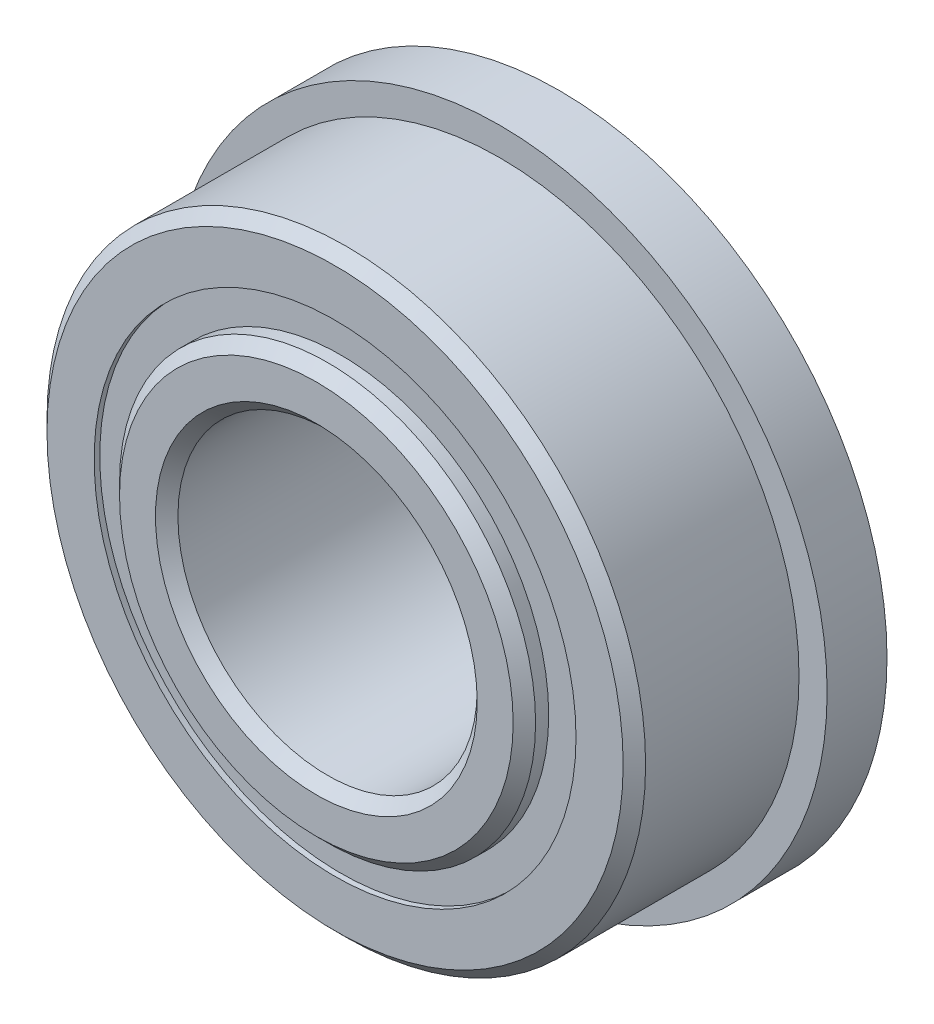
from build123d import *

# Parameters (mm, degrees)
CIRPATTERN1_COUNT = 12
SKETCH5_W         = 1.147826059
SKETCH5_H         = 0.697802198
SKETCH6_W         = 1.27
SKETCH6_H         = 1.835498901


with BuildPart() as part:
    # Sketch1 → Revolve1 (revolve)
    with BuildSketch(Plane(origin=(0, 0, 0), x_dir=(0, 0, -1), z_dir=(1, 0, 0))):
        with BuildLine():
            Line((2.143125, 6.35), (-2.143125, 6.35))
            Line((-2.143125, 6.35), (-2.38125, 6.111875))
            Line((-2.38125, 6.111875), (-2.38125, 5.111401099))
            Line((-2.38125, 5.111401099), (-1.058333333, 5.111401099))
            ThreePointArc((-1.058333333, 5.111401099), (0, 5.876861441), (1.058333333, 5.111401099))
            Line((1.058333333, 5.111401099), (2.38125, 5.111401099))
            Line((2.38125, 5.111401099), (2.38125, 6.111875))
            Line((2.38125, 6.111875), (2.143125, 6.35))
        make_face()
    revolve(axis=Axis((0, 0, 2.38125), (0, 0, -1)))

    # Sketch6 → Revolve6 (revolve)
    with BuildSketch(Plane(origin=(0, 0, 0), x_dir=(0, 0, -1), z_dir=(1, 0, 0))):
        with Locations((1.74625, 6.02915055)):
            Rectangle(SKETCH6_W, SKETCH6_H)
    revolve(axis=Axis((0, 0, -2.38125), (0, 0, 1)))


with BuildPart() as body_2:
    # Sketch3 → Revolve3 (revolve)
    with BuildSketch(Plane(origin=(0, 0, 0), x_dir=(0, 0, -1), z_dir=(1, 0, 0))):
        with BuildLine():
            Line((-2.77876, 3.413125), (-2.77876, 4.175473901))
            Line((-2.77876, 4.175473901), (-2.540635, 4.413598901))
            Line((-2.540635, 4.413598901), (-1.058333333, 4.413598901))
            ThreePointArc((-1.058333333, 4.413598901), (0, 3.648138559), (1.058333333, 4.413598901))
            Line((1.058333333, 4.413598901), (2.540635, 4.413598901))
            Line((2.540635, 4.413598901), (2.77876, 4.175473901))
            Line((2.77876, 4.175473901), (2.77876, 3.413125))
            Line((2.77876, 3.413125), (2.540635, 3.175))
            Line((2.540635, 3.175), (-2.540635, 3.175))
            Line((-2.540635, 3.175), (-2.77876, 3.413125))
        make_face()
    revolve(axis=Axis((0, 0, 2.38125), (0, 0, -1)))


with BuildPart() as body_3:
    # Sketch4 → Revolve4 (revolve)
    with BuildSketch(Plane(origin=(0, 0, 0), x_dir=(0, 0, -1), z_dir=(1, 0, 0))):
        with BuildLine():
            Line((-1.114361441, 4.7625), (1.114361441, 4.7625))
            ThreePointArc((1.114361441, 4.7625), (0, 5.876861441), (-1.114361441, 4.7625))
        make_face()
    revolve(axis=Axis((0, 4.7625, 1.114361441), (0, 0, -1)))


with BuildPart() as cirpattern1_1:
    # CirPattern1: pattern copy
    add(body_3.part.rotate(Axis((0, 0, -2.38125), (0, 0, 1)), 1 * 360 / CIRPATTERN1_COUNT))


with BuildPart() as cirpattern1_2:
    # CirPattern1: pattern copy
    add(body_3.part.rotate(Axis((0, 0, -2.38125), (0, 0, 1)), 2 * 360 / CIRPATTERN1_COUNT))


with BuildPart() as cirpattern1_3:
    # CirPattern1: pattern copy
    add(body_3.part.rotate(Axis((0, 0, -2.38125), (0, 0, 1)), 3 * 360 / CIRPATTERN1_COUNT))


with BuildPart() as cirpattern1_4:
    # CirPattern1: pattern copy
    add(body_3.part.rotate(Axis((0, 0, -2.38125), (0, 0, 1)), 4 * 360 / CIRPATTERN1_COUNT))


with BuildPart() as cirpattern1_5:
    # CirPattern1: pattern copy
    add(body_3.part.rotate(Axis((0, 0, -2.38125), (0, 0, 1)), 5 * 360 / CIRPATTERN1_COUNT))


with BuildPart() as cirpattern1_6:
    # CirPattern1: pattern copy
    add(body_3.part.rotate(Axis((0, 0, -2.38125), (0, 0, 1)), 6 * 360 / CIRPATTERN1_COUNT))


with BuildPart() as cirpattern1_7:
    # CirPattern1: pattern copy
    add(body_3.part.rotate(Axis((0, 0, -2.38125), (0, 0, 1)), 7 * 360 / CIRPATTERN1_COUNT))


with BuildPart() as cirpattern1_8:
    # CirPattern1: pattern copy
    add(body_3.part.rotate(Axis((0, 0, -2.38125), (0, 0, 1)), 8 * 360 / CIRPATTERN1_COUNT))


with BuildPart() as cirpattern1_9:
    # CirPattern1: pattern copy
    add(body_3.part.rotate(Axis((0, 0, -2.38125), (0, 0, 1)), 9 * 360 / CIRPATTERN1_COUNT))


with BuildPart() as cirpattern1_10:
    # CirPattern1: pattern copy
    add(body_3.part.rotate(Axis((0, 0, -2.38125), (0, 0, 1)), 10 * 360 / CIRPATTERN1_COUNT))


with BuildPart() as cirpattern1_11:
    # CirPattern1: pattern copy
    add(body_3.part.rotate(Axis((0, 0, -2.38125), (0, 0, 1)), 11 * 360 / CIRPATTERN1_COUNT))


with BuildPart() as body_15:
    # Sketch5 → Revolve5 (revolve)
    with BuildSketch(Plane(origin=(0, 0, 0), x_dir=(0, 0, -1), z_dir=(1, 0, 0))):
        with Locations((-1.688274471, 4.7625)):
            Rectangle(SKETCH5_W, SKETCH5_H)
        with Locations((1.688274471, 4.7625)):
            Rectangle(SKETCH5_W, SKETCH5_H)
    revolve(axis=Axis((0, 0, 2.38125), (0, 0, -1)))


solid = Compound([part.part, body_2.part, body_3.part, cirpattern1_1.part, cirpattern1_2.part, cirpattern1_3.part, cirpattern1_4.part, cirpattern1_5.part, cirpattern1_6.part, cirpattern1_7.part, cirpattern1_8.part, cirpattern1_9.part, cirpattern1_10.part, cirpattern1_11.part, body_15.part])
